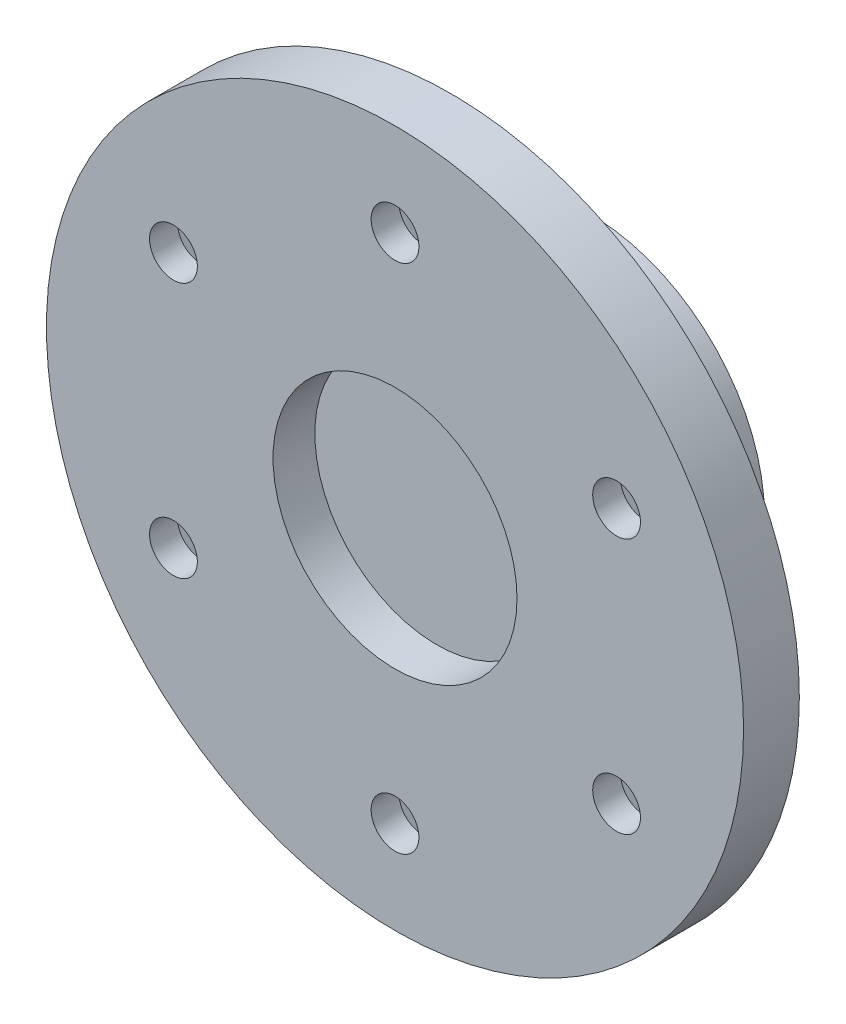
from build123d import *

# Parameters (mm, degrees)
SKETCH1_R               = 25
BOSS_EXTRUDE1_DEPTH     = 4
SKETCH2_R               = 1.713577746
CUT_EXTRUDE1_DEPTH      = 4
CUT_EXTRUDE2_DEPTH      = 2
SKETCH4_R               = 12.5
SKETCH4_R_2             = 2.5
BOSS_EXTRUDE2_DEPTH     = 10
SKETCH5_R               = 1.6
CUT_EXTRUDE3_DEPTH      = 12.5
SKETCH6_R               = 3.1
CUT_EXTRUDE4_DEPTH      = 6
FILLET1_R               = 1.5
SKETCH9_R               = 8.75
CUT_EXTRUDE6_DEPTH      = 3
SKETCH12_W              = 5.5
SKETCH12_H              = 2.5
CUT_EXTRUDE7_DEPTH      = 10
CUT_EXTRUDE8_DEPTH      = 10
CUT_EXTRUDE8_DEPTH_BACK = 2
SKETCH17_R              = 1.6
CUT_EXTRUDE9_DEPTH      = 30
CUT_EXTRUDE9_DEPTH_BACK = 2
SKETCH18_R              = 1.6
CUT_EXTRUDE10_START     = -3
SKETCH20_R              = 3.1
CUT_EXTRUDE10_DEPTH     = 4
CUT_EXTRUDE11_START     = -3
SKETCH21_R              = 3.1
CUT_EXTRUDE11_DEPTH     = 4


with BuildPart() as part:
    # Sketch1 → Boss-Extrude1 (new body)
    with BuildSketch(Plane.XY):
        Circle(SKETCH1_R)
    extrude(amount=BOSS_EXTRUDE1_DEPTH)

    # Sketch2 → Cut-Extrude1 (cut)
    with BuildSketch(Plane(origin=(0, 0, 0), x_dir=(-1, 0, 0), z_dir=(0, 0, -1))):
        with Locations((0, 18.35)):
            Circle(SKETCH2_R)
        with Locations((15.891566159, 9.175)):
            Circle(SKETCH2_R)
        with Locations((15.891566159, -9.175)):
            Circle(SKETCH2_R)
        with Locations((0, -18.35)):
            Circle(SKETCH2_R)
        with Locations((-15.891566159, -9.175)):
            Circle(SKETCH2_R)
        with Locations((-15.891566159, 9.175)):
            Circle(SKETCH2_R)
    extrude(amount=-CUT_EXTRUDE1_DEPTH, mode=Mode.SUBTRACT)

    # Sketch3 → Cut-Extrude2 (cut)
    with BuildSketch(Plane(origin=(0, 0, 0), x_dir=(-1, 0, 0), z_dir=(0, 0, -1))):
        Polygon((13.870840217, 5.675), (17.912292102, 5.675), (19.933018044, 9.175), (17.912292102, 12.675), (13.870840217, 12.675), (11.850114275, 9.175), align=None)
        Polygon((4.041451884, 18.35), (2.020725942, 21.85), (-2.020725942, 21.85), (-4.041451884, 18.35), (-2.020725942, 14.85), (2.020725942, 14.85), align=None)
        Polygon((11.850114275, -9.175), (13.870840217, -12.675), (17.912292102, -12.675), (19.933018044, -9.175), (17.912292102, -5.675), (13.870840217, -5.675), align=None)
        Polygon((-2.020725942, -14.85), (-4.041451884, -18.35), (-2.020725942, -21.85), (2.020725942, -21.85), (4.041451884, -18.35), (2.020725942, -14.85), align=None)
        Polygon((-13.870840217, -5.675), (-17.912292102, -5.675), (-19.933018044, -9.175), (-17.912292102, -12.675), (-13.870840217, -12.675), (-11.850114275, -9.175), align=None)
        Polygon((-11.850114275, 9.175), (-13.870840217, 12.675), (-17.912292102, 12.675), (-19.933018044, 9.175), (-17.912292102, 5.675), (-13.870840217, 5.675), align=None)
    extrude(amount=-CUT_EXTRUDE2_DEPTH, mode=Mode.SUBTRACT)

    # Sketch4 → Boss-Extrude2 (add)
    with BuildSketch(Plane(origin=(0, 0, 0), x_dir=(-1, 0, 0), z_dir=(0, 0, -1))):
        with Locations(Location((0, 0, 0), (0, 0, 180))):
            Circle(SKETCH4_R)
        with Locations((0, 0.5)):
            Circle(SKETCH4_R_2, mode=Mode.SUBTRACT)
    extrude(amount=BOSS_EXTRUDE2_DEPTH)

    # Sketch5 → Cut-Extrude3 (cut)
    with BuildSketch(Plane(origin=(0, 12.5, 0), x_dir=(1, 0, 0), z_dir=(0, 1, 0))):
        with Locations(Location((0, 5, 0), (0, 0, 270))):
            Circle(SKETCH5_R)
    extrude(amount=-CUT_EXTRUDE3_DEPTH, mode=Mode.SUBTRACT)

    # Sketch6 → Cut-Extrude4 (cut)
    with BuildSketch(Plane(origin=(0, 12.5, 0), x_dir=(1, 0, 0), z_dir=(0, 1, 0))):
        with Locations(Location((0, 5, 0), (0, 0, 270))):
            Circle(SKETCH6_R)
    extrude(amount=-CUT_EXTRUDE4_DEPTH, mode=Mode.SUBTRACT)

    # Fillet1
    fillet1_edges = [part.edges().sort_by_distance(p)[0] for p in [
        (-12.5, 0, 0),
    ]]
    fillet(fillet1_edges, radius=FILLET1_R)

    # Sketch9 → Cut-Extrude6 (cut)
    with BuildSketch(Plane.XY.offset(4)):
        Circle(SKETCH9_R)
    extrude(amount=-CUT_EXTRUDE6_DEPTH, mode=Mode.SUBTRACT)

    # Sketch12 → Cut-Extrude7 (cut)
    with BuildSketch(Plane(origin=(0, 0, -10), x_dir=(-1, 0, 0), z_dir=(0, 0, -1))):
        Polygon((1.223076211, -3.88156986), (3.973076211, 0.88156986), (6.138139721, -0.36843014), (3.388139721, -5.13156986), align=None)
        with Locations((0, 3.25)):
            Rectangle(SKETCH12_W, SKETCH12_H)
        Polygon((-3.388139721, -5.13156986), (-1.223076211, -3.88156986), (-3.973076211, 0.88156986), (-6.138139721, -0.36843014), align=None)
    extrude(amount=-CUT_EXTRUDE7_DEPTH, mode=Mode.SUBTRACT)

    # Sketch17 → Cut-Extrude8 (cut, two sides: drawn at the far end of the back side and taken through both)
    with BuildSketch(Plane(origin=(2.598076211, -1.5, 0), x_dir=(0, 0, -1), z_dir=(0.8660254037844387, -0.4999999999999998, 0)).offset(-CUT_EXTRUDE8_DEPTH_BACK)):
        with Locations(Location((5, 0, 0), (0, 0, 90))):
            Circle(SKETCH17_R)
    extrude(amount=CUT_EXTRUDE8_DEPTH + CUT_EXTRUDE8_DEPTH_BACK, mode=Mode.SUBTRACT)

    # Sketch18 → Cut-Extrude9 (cut, two sides: drawn at the far end of the back side and taken through both)
    with BuildSketch(Plane(origin=(-2.598076211, -1.5, 0), x_dir=(0, 0, 1), z_dir=(-0.8660254037844388, -0.49999999999999983, 0)).offset(-CUT_EXTRUDE9_DEPTH_BACK)):
        with Locations(Location((-5, 0, 0), (0, 0, 90))):
            Circle(SKETCH18_R)
    extrude(amount=CUT_EXTRUDE9_DEPTH + CUT_EXTRUDE9_DEPTH_BACK, mode=Mode.SUBTRACT)

    # Sketch20 → Cut-Extrude10 (cut)
    with BuildSketch(Plane(origin=(-4.763139721, -2.75, 0), x_dir=(0, 0, -1), z_dir=(0.866025403784439, 0.4999999999999994, 0)).offset(CUT_EXTRUDE10_START)):
        with Locations(Location((5, 0, 0), (0, 0, 90))):
            Circle(SKETCH20_R)
    extrude(amount=-CUT_EXTRUDE10_DEPTH, mode=Mode.SUBTRACT)

    # Sketch21 → Cut-Extrude11 (cut)
    with BuildSketch(Plane(origin=(4.763139721, -2.75, 0), x_dir=(0, 0, 1), z_dir=(-0.866025403784439, 0.4999999999999994, 0)).offset(CUT_EXTRUDE11_START)):
        with Locations(Location((-5, 0, 0), (0, 0, 270))):
            Circle(SKETCH21_R)
    extrude(amount=-CUT_EXTRUDE11_DEPTH, mode=Mode.SUBTRACT)


solid = part.part
